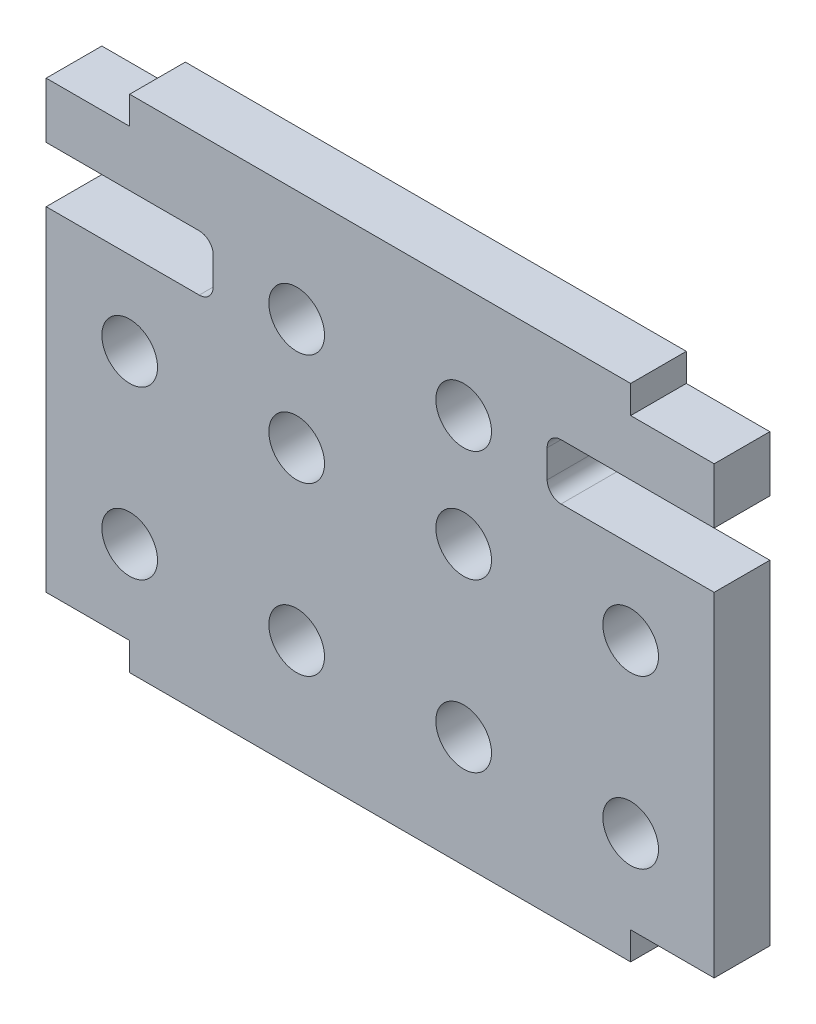
from build123d import *

# Parameters (mm, degrees)
MODEL_R                 = 1.5
SALIENTE_EXTRUIR1_DEPTH = 3


with BuildPart() as part:
    # Model → Saliente-Extruir1 (new body)
    with BuildSketch(Plane.XY):
        with BuildLine():
            Line((105.875172656, 202.089330986), (105.875172656, 205.089330986))
            Line((105.875172656, 205.089330986), (110.375172306, 205.089330986))
            Line((110.375172306, 205.089330986), (110.375172306, 206.589330986))
            Line((110.375172306, 206.589330986), (137.375172656, 206.589330986))
            Line((137.375172656, 206.589330986), (137.375172656, 205.089330986))
            Line((137.375172656, 205.089330986), (141.875172656, 205.089330986))
            Line((141.875172656, 205.089330986), (141.875172656, 202.089330986))
            Line((141.875172656, 202.089330986), (133.625172656, 202.089319857))
            ThreePointArc((133.625172656, 202.089319857), (133.094842866, 201.869649228), (132.875173667, 201.339318846))
            Line((132.875173667, 201.339318846), (132.875175691, 199.839318846))
            ThreePointArc((132.875175691, 199.839318846), (133.09484632, 199.308989056), (133.625176703, 199.089319857))
            Line((133.625176703, 199.089319857), (141.875172656, 199.089330986))
            Line((141.875172656, 199.089330986), (141.875172656, 181.089330986))
            Line((141.875172656, 181.089330986), (137.375172656, 181.089330986))
            Line((137.375172656, 181.089330986), (137.375172656, 179.589330986))
            Line((137.375172656, 179.589330986), (110.375172306, 179.589330986))
            Line((110.375172306, 179.589330986), (110.375172306, 181.089330986))
            Line((110.375172306, 181.089330986), (105.875172656, 181.089330986))
            Line((105.875172656, 181.089330986), (105.875172656, 199.089330986))
            Line((105.875172656, 199.089330986), (114.125172656, 199.089330986))
            ThreePointArc((114.125172656, 199.089330986), (114.655502742, 199.3090009), (114.875172656, 199.839330986))
            Line((114.875172656, 199.839330986), (114.875172656, 201.339330986))
            ThreePointArc((114.875172656, 201.339330986), (114.655502742, 201.869661072), (114.125172656, 202.089330986))
            Line((114.125172656, 202.089330986), (105.875172656, 202.089330986))
        make_face()
        with Locations((128.375172656, 200.589330986)):
            Circle(MODEL_R, mode=Mode.SUBTRACT)
        with Locations((119.375172656, 200.589330986)):
            Circle(MODEL_R, mode=Mode.SUBTRACT)
        with Locations((137.375172306, 185.589330986)):
            Circle(MODEL_R, mode=Mode.SUBTRACT)
        with Locations((128.375172306, 185.589330986)):
            Circle(MODEL_R, mode=Mode.SUBTRACT)
        with Locations((110.375172306, 185.589330986)):
            Circle(MODEL_R, mode=Mode.SUBTRACT)
        with Locations((119.375172306, 185.589330986)):
            Circle(MODEL_R, mode=Mode.SUBTRACT)
        with Locations((137.375172306, 194.589330986)):
            Circle(MODEL_R, mode=Mode.SUBTRACT)
        with Locations((128.375172306, 194.589330986)):
            Circle(MODEL_R, mode=Mode.SUBTRACT)
        with Locations((110.375172306, 194.589330986)):
            Circle(MODEL_R, mode=Mode.SUBTRACT)
        with Locations((119.375172306, 194.589330986)):
            Circle(MODEL_R, mode=Mode.SUBTRACT)
    extrude(amount=SALIENTE_EXTRUIR1_DEPTH)


solid = part.part
